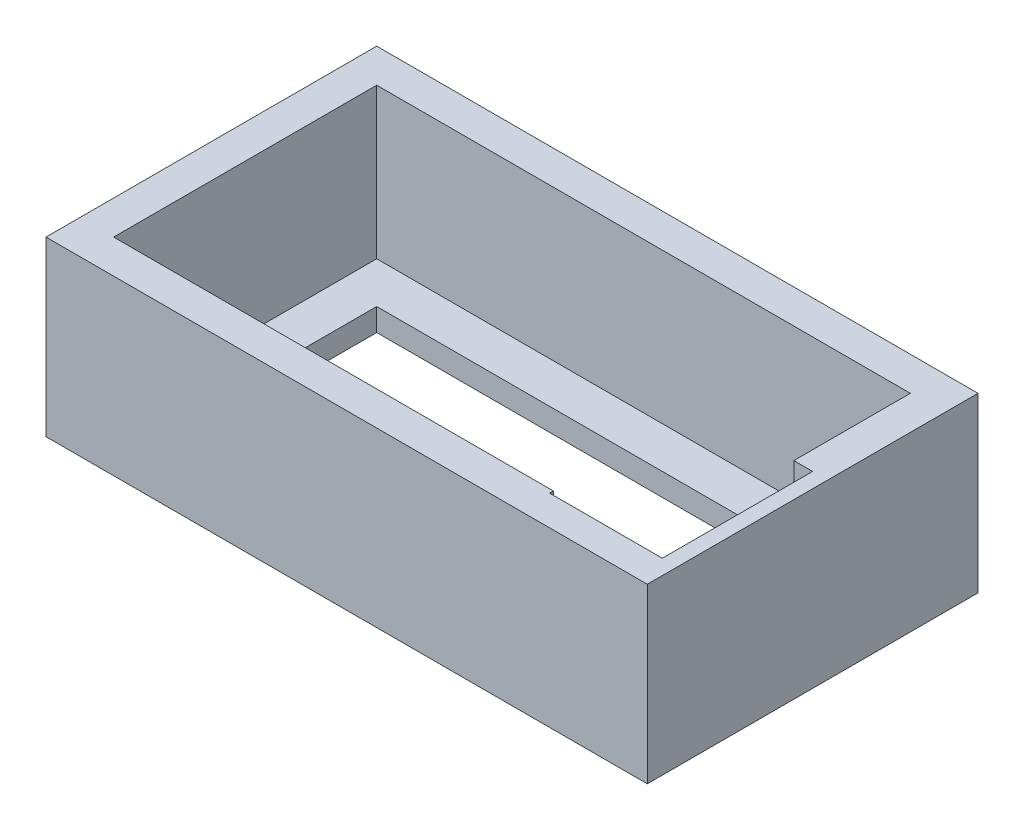
from build123d import *

# Parameters (mm, degrees)
SKETCH1_W           = 80
SKETCH1_H           = 44
SKETCH1_W_2         = 60
SKETCH1_H_2         = 24
BOSS_EXTRUDE1_DEPTH = 3
SKETCH2_W           = 80
SKETCH2_H           = 44
SKETCH2_W_2         = 71
SKETCH2_H_2         = 35
BOSS_EXTRUDE2_DEPTH = 20
CUT_EXTRUDE1_REACH  = 53.118
SKETCH3_W           = 15
SKETCH3_H           = 20


with BuildPart() as part:
    # Sketch1 → Boss-Extrude1 (new body)
    with BuildSketch(Plane(origin=(0, 0, 0), x_dir=(1, 0, 0), z_dir=(0, 1, 0))):
        Rectangle(SKETCH1_W, SKETCH1_H)
        Rectangle(SKETCH1_W_2, SKETCH1_H_2, mode=Mode.SUBTRACT)
    extrude(amount=BOSS_EXTRUDE1_DEPTH)

    # Sketch2 → Boss-Extrude2 (add)
    with BuildSketch(Plane(origin=(0, 3, 0), x_dir=(1, 0, 0), z_dir=(0, 1, 0))):
        Rectangle(SKETCH2_W, SKETCH2_H)
        Rectangle(SKETCH2_W_2, SKETCH2_H_2, mode=Mode.SUBTRACT)
    extrude(amount=BOSS_EXTRUDE2_DEPTH)

    # Sketch3 → Cut-Extrude1 (cut, up to next)
    with BuildSketch(Plane(origin=(0, 0, 0), x_dir=(-1, 0, 0), z_dir=(0, -1, 0)), mode=Mode.PRIVATE) as cut_extrude1_sk1:
        with Locations((-30.5, -8)):
            Rectangle(SKETCH3_W, SKETCH3_H)
    cut_extrude1_tool1 = extrude(cut_extrude1_sk1.sketch, amount=-CUT_EXTRUDE1_REACH, mode=Mode.PRIVATE) & part.part
    add(cut_extrude1_tool1.solids().sort_by_distance((30.5, 0, 8))[0], mode=Mode.SUBTRACT)


solid = part.part
